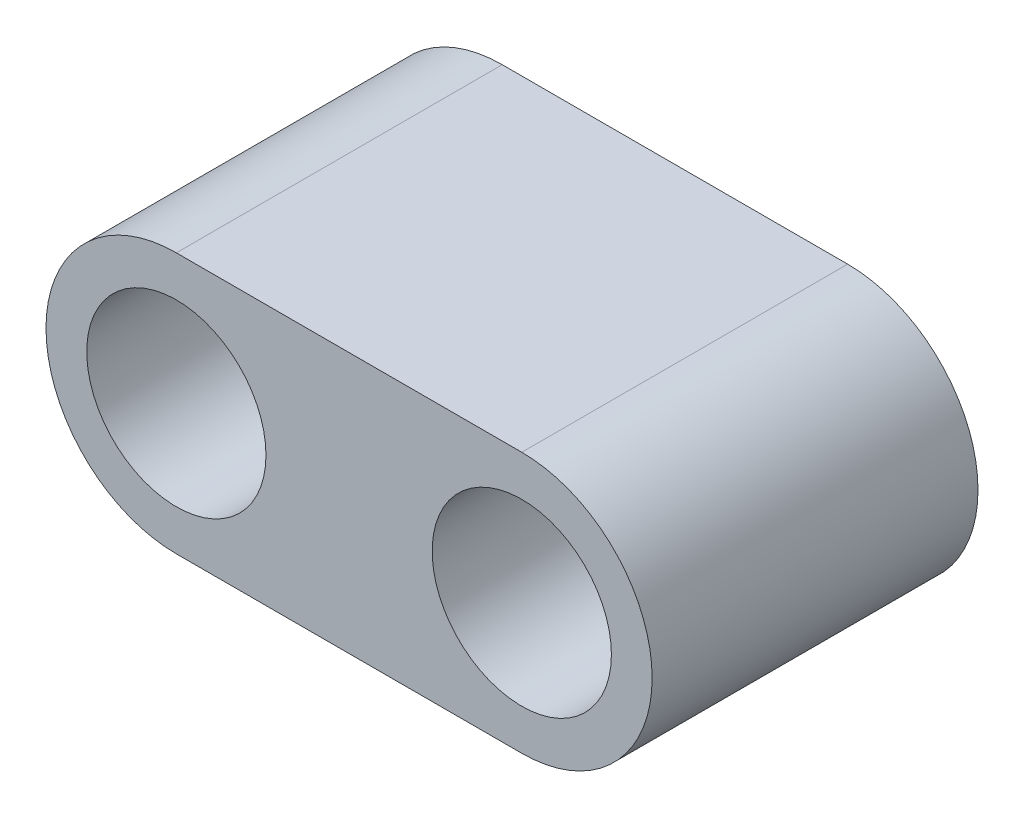
from build123d import *

# Parameters (mm, degrees)
BOSS_EXTRUDE1_DEPTH = 100
SKETCH2_R           = 27.5
CUT_EXTRUDE1_DEPTH  = 195.206076115


with BuildPart() as part:
    # Sketch1 → Boss-Extrude1 (new body)
    with BuildSketch(Plane.XY):
        with BuildLine():
            Line((0, 0), (106, 0))
            ThreePointArc((106, 0), (146, -40), (106, -80))
            Line((106, -80), (0, -80))
            ThreePointArc((0, -80), (-40, -40), (0, 0))
        make_face()
    extrude(amount=BOSS_EXTRUDE1_DEPTH)

    # Sketch2 → Cut-Extrude1 (cut, through all)
    with BuildSketch(Plane.XY.offset(100)):
        with Locations((0, -40)):
            Circle(SKETCH2_R)
        with Locations((106, -40)):
            Circle(SKETCH2_R)
    extrude(amount=-CUT_EXTRUDE1_DEPTH, mode=Mode.SUBTRACT)


solid = part.part
